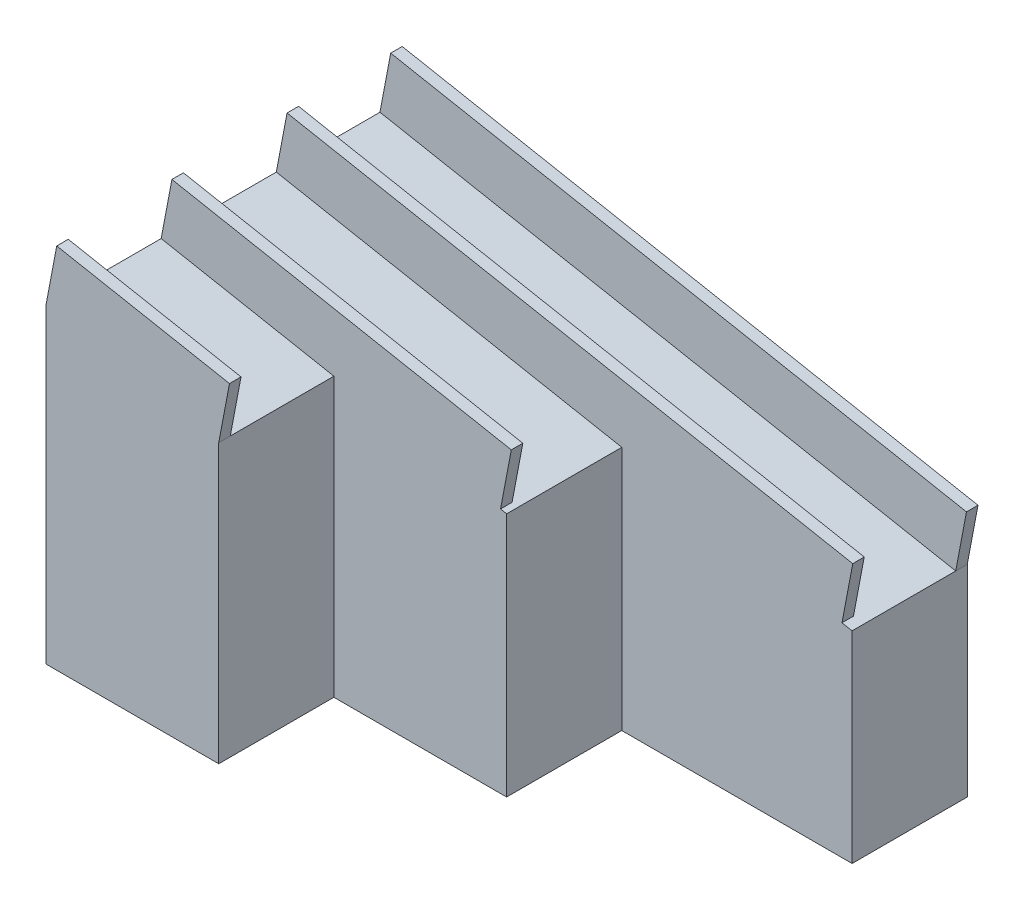
from build123d import *

# Parameters (mm, degrees)
BOSS_EXTRUDE1_DEPTH = 20
BOSS_EXTRUDE2_DEPTH = 20
BOSS_EXTRUDE3_DEPTH = 20
SKETCH4_W           = 101.78899744
SKETCH4_H           = 2
SKETCH4_W_2         = 100
SKETCH4_W_3         = 60
SKETCH4_W_4         = 30.536699232
BOSS_EXTRUDE4_DEPTH = 10


with BuildPart() as part:
    # Sketch1 → Boss-Extrude1 (new body)
    with BuildSketch(Plane.XY):
        Polygon((0, 0), (0, 54), (100, 35), (100, 0), align=None)
    extrude(amount=BOSS_EXTRUDE1_DEPTH)

    # Sketch2 → Boss-Extrude2 (add)
    with BuildSketch(Plane.XY.offset(20)):
        Polygon((0, 54), (0, 0), (60, 0), (60, 42.6), align=None)
    extrude(amount=BOSS_EXTRUDE2_DEPTH)

    # Sketch3 → Boss-Extrude3 (add)
    with BuildSketch(Plane.XY.offset(40)):
        Polygon((0, 54), (0, 0), (30, 0), (30, 48.3), align=None)
    extrude(amount=BOSS_EXTRUDE3_DEPTH)

    # Sketch4 → Boss-Extrude4 (add)
    with BuildSketch(Plane(origin=(9.902519062, 52.118521378, 0), x_dir=(0.982424451701422, -0.1866606458232701, 0), z_dir=(0.1866606458232701, 0.982424451701422, 0))):
        with Locations((40.814823846, -1)):
            Rectangle(SKETCH4_W, SKETCH4_H)
        with Locations((39.920325126, -19)):
            Rectangle(SKETCH4_W_2, SKETCH4_H)
        with Locations((19.920325126, -39)):
            Rectangle(SKETCH4_W_3, SKETCH4_H)
        with Locations((5.188674742, -59)):
            Rectangle(SKETCH4_W_4, SKETCH4_H)
    extrude(amount=BOSS_EXTRUDE4_DEPTH)


solid = part.part
